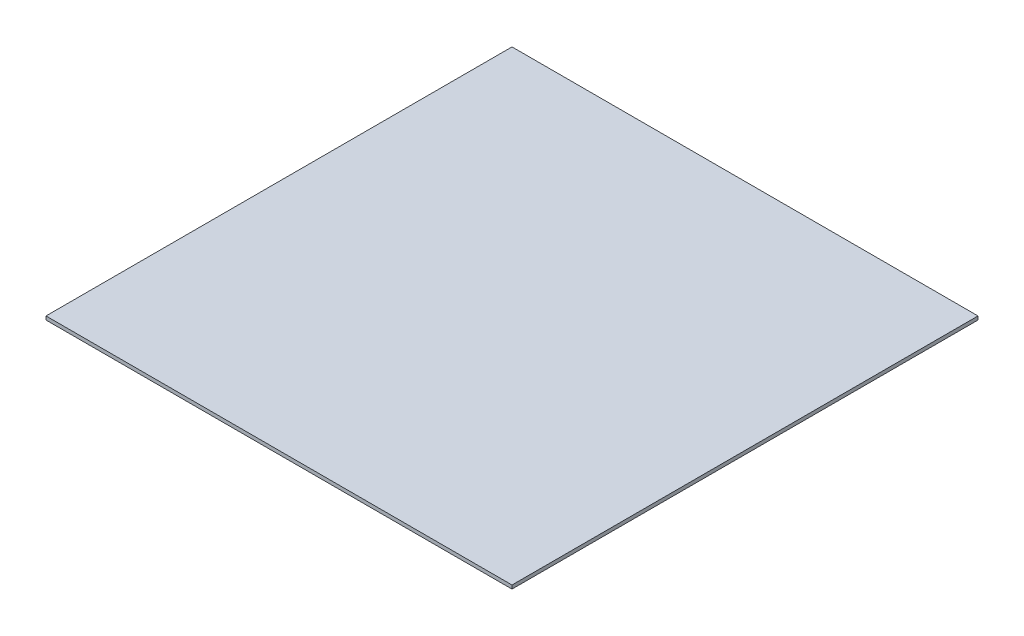
from build123d import *

# Parameters (mm, degrees)
CROQUIS1_W              = 390
CROQUIS1_H              = 390
SALIENTE_EXTRUIR1_DEPTH = 3


with BuildPart() as part:
    # Croquis1 → Saliente-Extruir1 (new body)
    with BuildSketch(Plane(origin=(0, 0, 0), x_dir=(1, 0, 0), z_dir=(0, 1, 0))):
        Rectangle(CROQUIS1_W, CROQUIS1_H)
    extrude(amount=SALIENTE_EXTRUIR1_DEPTH)


solid = part.part
